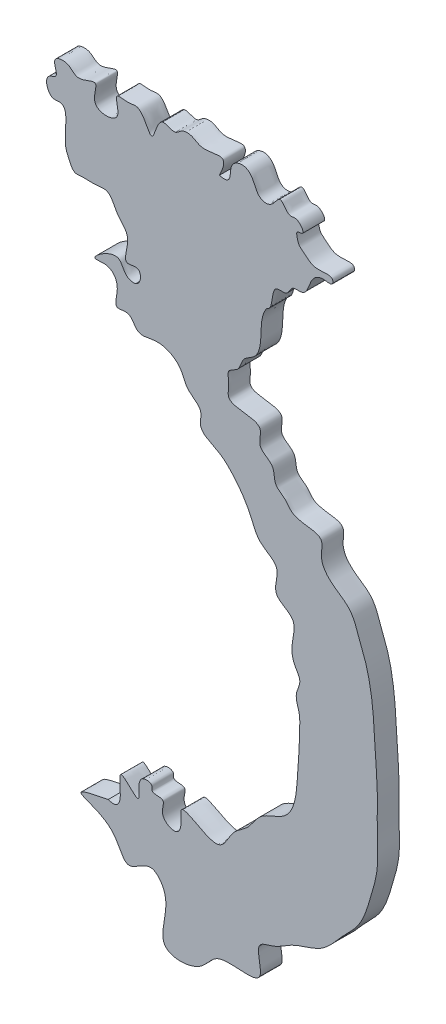
from build123d import *

# Parameters (mm, degrees)
BOSS_EXTRUDE3_DEPTH = 3


with BuildPart() as part:
    # Sketch1 → Boss-Extrude3 (new body)
    with BuildSketch(Plane.XY):
        with BuildLine():
            add(Edge.make_bspline(
                [(-14.118193872, 11.579528592), (-12.064577969, 11.048119495), (-13.373725021, 13.678716664), (-10.821091961, 14.688383102), (-9.265281705, 13.510673301), (-8.984431157, 11.505746809), (-6.720613973, 11.313826564), (-5.693851552, 13.854664763), (-4.691617847, 11.278460886), (-3.275605347, 11.986700955), (-2.010209092, 10.14340848), (-3.601173508, 10.35162152), (-3.333151996, 9.39821924), (-3.164160523, 8.682530519), (-2.32921031, 8.060495972), (-1.350276476, 7.161677527), (0.007921758, 7.090974698), (1.584581481, 7.29736686), (1.59012172, 5.991694705), (-0.29908845, 6.693508308), (-1.421388143, 5.462894623), (-1.806937276, 4.175166159), (-2.511957806, 2.951704716), (-4.196372852, 3.511049661), (-4.61915505, 1.697121261), (-7.307727959, 2.560415197), (-6.529472815, -0.873753772), (-7.569762142, -1.093924852)],
                knots=[0, 0, 0, 0, 0.088042541, 0.136072242, 0.169061582, 0.23615607, 0.272754457, 0.322275278, 0.371796099, 0.394670091, 0.436701595, 0.455563972, 0.478437964, 0.492904747, 0.518783714, 0.558137618, 0.59685028, 0.637230688, 0.646380285, 0.685975626, 0.739603079, 0.764239122, 0.79996944, 0.836852643, 0.872582961, 0.909466164, 1, 1, 1, 1], degree=3))
            add(Edge.make_bspline(
                [(-7.569762142, -1.093924852), (-8.475786159, -2.378900222), (-8.161265009, -4.632765331), (-8.823238605, -7.826188406), (-11.065697569, -8.572478478), (-11.214889036, -10.568521787), (-13.227672939, -11.060792316), (-12.629500853, -12.788494203), (-13.57578718, -15.746342659), (-7.459370387, -14.540413904), (-9.102086782, -18.448653391), (-6.310407673, -19.249364113), (-6.71612977, -21.784866931), (-4.929780818, -22.549651603), (-3.735487767, -24.809768975), (0.706497141, -23.907002365), (-0.376274318, -27.567568794), (1.403606591, -29.772784037), (4.298965152, -31.216281668), (5.116758177, -34.176524788), (6.201846984, -36.749076646), (6.903108059, -39.741889217), (7.27141769, -43.369773535), (7.463491201, -47.384357074), (7.831588996, -51.707816413), (7.619000328, -56.105263632), (7.976437823, -60.593507222), (6.739678699, -64.657344639), (5.589651535, -68.5711127), (2.629022627, -71.212794149), (0.232598788, -74.510465537), (-3.897010862, -75.191797355), (-6.20922497, -77.12155924), (-9.198415283, -77.614933855), (-8.483225605, -79.887585872), (-8.30003693, -83.264875566), (-14.461170599, -80.878871644), (-16.503979192, -85.445099081), (-22.909378632, -85.658573614), (-21.380815128, -80.624540264), (-21.540905665, -77.706746393), (-23.854436371, -75.236482381), (-27.143601046, -78.869302983), (-28.857974543, -71.579032798), (-37.128775875, -72.392008921), (-29.500712304, -70.902454317)],
                knots=[0, 0, 0, 0, 0.031363787, 0.050358716, 0.062605102, 0.076420781, 0.08669606, 0.097088935, 0.109213955, 0.142828474, 0.156685641, 0.17383342, 0.188160101, 0.201164237, 0.21037091, 0.241732929, 0.255590096, 0.275806526, 0.298148685, 0.322949239, 0.337748699, 0.359174159, 0.38882372, 0.41659213, 0.44608951, 0.482464572, 0.511911051, 0.542161677, 0.57400679, 0.597310429, 0.626873221, 0.658851034, 0.680860332, 0.694052495, 0.713106099, 0.720034682, 0.762557742, 0.786242724, 0.820885641, 0.850203347, 0.872986168, 0.886514659, 0.910479758, 0.936516699, 1, 1, 1, 1], degree=3))
            add(Edge.make_bspline(
                [(-29.500712304, -70.902454317), (-26.695226399, -71.959552993), (-29.545344559, -63.975187208), (-24.329520823, -70.744861297), (-25.969788884, -65.588834569), (-23.263688388, -65.931030683), (-23.651958808, -67.244960763), (-21.271552522, -66.747247594), (-22.705469882, -69.234667032), (-19.91961218, -70.730101228), (-19.26766567, -68.712300842), (-19.99999497, -65.316345107), (-13.958317442, -70.791853765), (-12.603014564, -65.994018196), (-9.960049228, -64.795072557), (-8.548449624, -61.744859046), (-4.680376729, -61.2368221), (-3.433628927, -57.735417421), (-3.341611382, -54.858927053), (-3.083725426, -52.095733382), (-3.0276371, -49.586022422), (-2.927855497, -47.301302776), (-3.857032471, -45.341372469), (-2.563451399, -43.4514711), (-4.066356148, -41.671801704), (-4.193980876, -39.340632424), (-3.1996631, -36.165160982), (-7.277836679, -35.040970515), (-5.250011224, -31.114085412), (-8.793521183, -29.882547205), (-9.914744264, -26.312149815), (-11.939380762, -23.550981643), (-14.39169055, -21.316266592), (-17.241597544, -20.463870358), (-16.235287644, -17.504815297), (-18.756705963, -16.524287784), (-19.325536726, -13.941161807), (-21.484081427, -12.651099197), (-23.560229236, -12.697252583), (-25.664690547, -13.302482401), (-26.32254569, -10.833284572), (-28.976165268, -11.827575538), (-27.741263672, -8.73129963), (-29.155324089, -6.64139109), (-32.73514277, -7.456262607), (-27.749208808, -3.889991126), (-27.393370714, -7.198744596), (-24.965293512, -7.421657038), (-24.912613785, -4.724743338), (-27.892084941, -5.989405033), (-26.014747193, -1.912387979), (-28.416618364, -0.44758734), (-29.208191182, 2.266078533), (-31.449206298, 1.760803658), (-32.790412096, 1.990866623), (-34.334269527, 1.699551239), (-34.91314654, 3.071353158), (-35.955662277, 5.203047758), (-34.559425783, 9.813749375), (-37.724936635, 8.963489861), (-38.587638107, 11.768894467), (-36.082514388, 11.977683159), (-37.678985657, 14.376372768), (-34.893102988, 14.746469277), (-33.814970962, 12.784457169), (-30.297238343, 15.154241067), (-32.502344013, 10.628211516), (-26.988616776, 10.655160568), (-29.091375919, 14.496692522), (-26.724582379, 13.812010115), (-24.774561214, 14.5960677), (-23.329600809, 9.497109549), (-22.630488184, 15.078396481), (-20.344285867, 13.220440582), (-19.358296585, 14.470954547), (-17.922590809, 14.537504282), (-15.864255195, 12.738427455), (-12.300099002, 15.262336229), (-14.118193872, 11.579528592)],
                knots=[0, 0, 0, 0, 0.025553485, 0.041920326, 0.057567975, 0.065100145, 0.067561957, 0.076057613, 0.08482674, 0.098158773, 0.106008221, 0.114777347, 0.144884476, 0.16344354, 0.177538393, 0.193082898, 0.215846871, 0.233854004, 0.249673916, 0.265388557, 0.28053505, 0.292251598, 0.303854832, 0.314471578, 0.324609716, 0.338166469, 0.354428774, 0.370849427, 0.388466925, 0.404887577, 0.420419936, 0.450118103, 0.460829454, 0.478566684, 0.488053029, 0.503042316, 0.513730291, 0.531091039, 0.539222192, 0.550063729, 0.561562915, 0.569694068, 0.581890797, 0.597233966, 0.605019041, 0.624568701, 0.637062955, 0.645194108, 0.654680453, 0.662811606, 0.679073911, 0.694685034, 0.708322213, 0.717338194, 0.728016714, 0.732940339, 0.741207247, 0.748289634, 0.777172783, 0.782096409, 0.795614982, 0.802086259, 0.812527123, 0.822647895, 0.831897669, 0.846008437, 0.859567027, 0.876660842, 0.890219431, 0.898350584, 0.906481737, 0.923841872, 0.939651711, 0.949887037, 0.955623952, 0.963067422, 0.971434996, 1, 1, 1, 1], degree=3))
        make_face()
    extrude(amount=BOSS_EXTRUDE3_DEPTH)


solid = part.part
